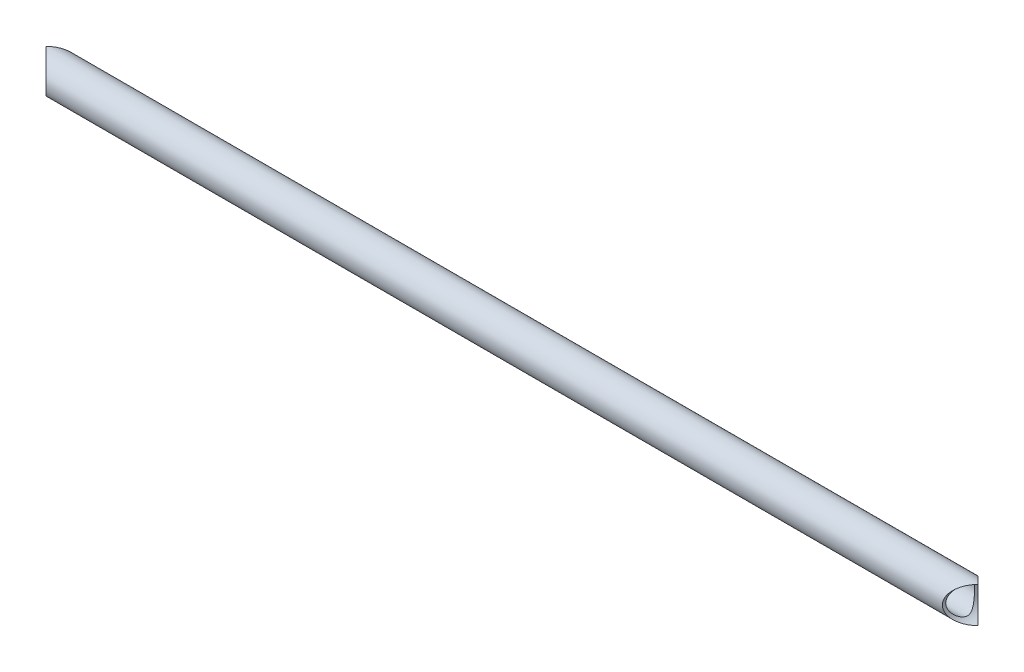
from build123d import *

# Parameters (mm, degrees)
SKETCH1_R                          = 7.9375
SKETCH1_R_2                        = 6.4375
PIPE_CONFIGURED_21_3_X_2_3_1_DEPTH = 415.043480752
CORTE_EXTRUS_O1_DEPTH              = 562.915780451
CORTE_EXTRUS_O1_DEPTH_BACK         = 562.915780451
ESBO_O9_R                          = 7.9375


with BuildPart() as part:
    # Sketch1 → Pipe - configured 21.3 X 2.3(1) (new body)
    with BuildSketch(Plane(origin=(58.531578249, 250, 150), x_dir=(0, 0, -1), z_dir=(1, 0, 0))):
        Circle(SKETCH1_R)
        Circle(SKETCH1_R_2, mode=Mode.SUBTRACT)
    extrude(amount=PIPE_CONFIGURED_21_3_X_2_3_1_DEPTH)

    # Esboço9 → Corte-extrusão1 (cut, two sides: drawn at the far end of the back side and taken through both)
    with BuildSketch(Plane.XY.offset(-CORTE_EXTRUS_O1_DEPTH_BACK)):
        with Locations((473.575059, 250)):
            Circle(ESBO_O9_R)
        with Locations((58.531578249, 250)):
            Circle(ESBO_O9_R)
    extrude(amount=CORTE_EXTRUS_O1_DEPTH + CORTE_EXTRUS_O1_DEPTH_BACK, mode=Mode.SUBTRACT)


solid = part.part
